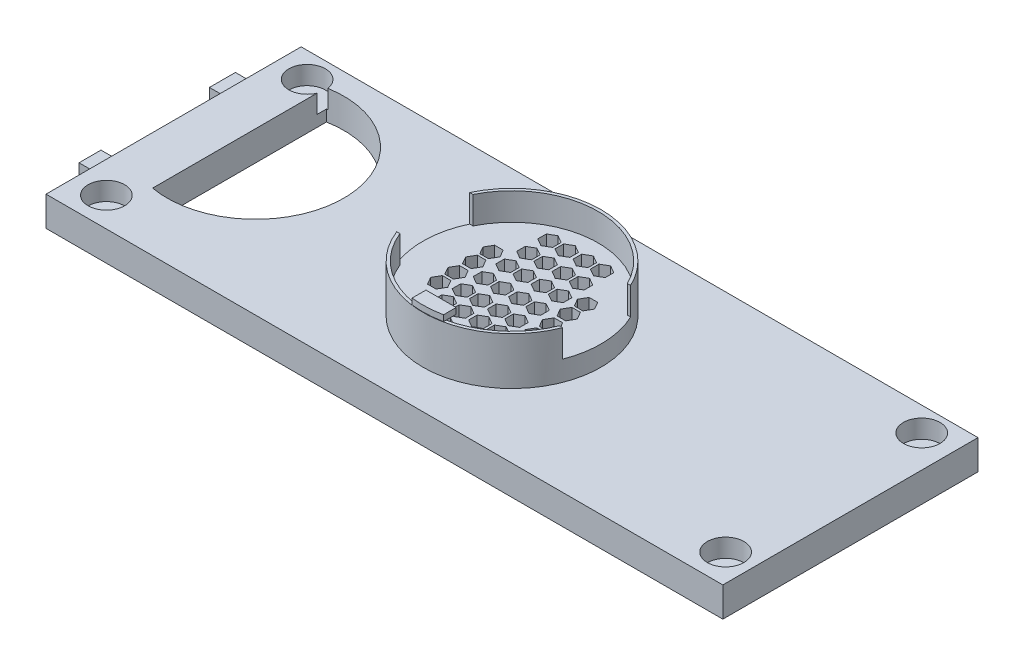
from build123d import *

# Parameters (mm, degrees)
SKETCH1_W           = 114
SKETCH1_H           = 42.97487903
BOSS_EXTRUDE1_DEPTH = 5
SKETCH3_R           = 3.08
CUT_EXTRUDE1_DEPTH  = 3.1
SKETCH5_W           = 4.374782862
SKETCH5_H           = 2
SKETCH5_W_2         = 3.698270048
SKETCH5_H_2         = 2.003550683
BOSS_EXTRUDE2_DEPTH = 3.1
SKETCH6_R           = 15
BOSS_EXTRUDE3_DEPTH = 8
SKETCH8_R           = 14.5
CUT_EXTRUDE2_DEPTH  = 4.6
SKETCH9_W           = 39.287811744
SKETCH9_H           = 11.865369085
CUT_EXTRUDE5_DEPTH  = 9.6
BOSS_EXTRUDE5_DEPTH = 1
CUT_EXTRUDE6_DEPTH  = 10
CUT_EXTRUDE7_DEPTH  = 10


with BuildPart() as part:
    # Sketch1 → Boss-Extrude1 (new body)
    with BuildSketch(Plane(origin=(0, 0, 0), x_dir=(1, 0, 0), z_dir=(0, 1, 0))):
        Rectangle(SKETCH1_W, SKETCH1_H)
    extrude(amount=BOSS_EXTRUDE1_DEPTH)

    # Sketch3 → Cut-Extrude1 (cut)
    with BuildSketch(Plane(origin=(0, 5, 0), x_dir=(1, 0, 0), z_dir=(0, 1, 0))):
        with Locations(Location((-51.753086156, 17.246929099, 0), (0, 0, 270))):
            Circle(SKETCH3_R)
        with Locations(Location((-51.753086156, -16.564851847, 0), (0, 0, 270))):
            Circle(SKETCH3_R)
        with Locations(Location((51.584956943, 17.425212087, 0), (0, 0, 270))):
            Circle(SKETCH3_R)
        with Locations(Location((52.43781039, -16.458146722, 0), (0, 0, 270))):
            Circle(SKETCH3_R)
    extrude(amount=-CUT_EXTRUDE1_DEPTH, mode=Mode.SUBTRACT)

    # Sketch5 → Boss-Extrude2 (add)
    with BuildSketch(Plane.ZY.offset(57)):
        with Locations((-11.3256423, 2.70029737)):
            Rectangle(SKETCH5_W, SKETCH5_H)
        with Locations((10.976730125, 2.691921307)):
            Rectangle(SKETCH5_W_2, SKETCH5_H_2)
    extrude(amount=BOSS_EXTRUDE2_DEPTH)

    # Sketch6 → Boss-Extrude3 (add)
    with BuildSketch(Plane(origin=(0, 5, 0), x_dir=(1, 0, 0), z_dir=(0, 1, 0))):
        with Locations(Location((0, 0, 0), (0, 0, 270))):
            Circle(SKETCH6_R)
    extrude(amount=BOSS_EXTRUDE3_DEPTH)

    # Sketch8 → Cut-Extrude2 (cut)
    with BuildSketch(Plane(origin=(0, 13, 0), x_dir=(1, 0, 0), z_dir=(0, 1, 0))):
        with Locations(Location((0, 0, 0), (0, 0, 270))):
            Circle(SKETCH8_R)
    extrude(amount=-CUT_EXTRUDE2_DEPTH, mode=Mode.SUBTRACT)

    # Sketch9 → Cut-Extrude5 (cut)
    with BuildSketch(Plane(origin=(0, 8.4, 0), x_dir=(1, 0, 0), z_dir=(0, 1, 0))):
        with Locations((1.303444601, 0.497081388)):
            Rectangle(SKETCH9_W, SKETCH9_H)
    extrude(amount=CUT_EXTRUDE5_DEPTH, mode=Mode.SUBTRACT)

    # Sketch11 → Boss-Extrude5 (add)
    with BuildSketch(Plane(origin=(0, 13, 0), x_dir=(1, 0, 0), z_dir=(0, 1, 0))):
        with BuildLine():
            Line((-2.008566412, -12.483358221), (-2.008566412, -14.813807369))
            ThreePointArc((-2.008566412, -14.813807369), (0.540430025, -14.915750705), (3.072767456, -14.607461209))
            Line((3.072767456, -14.607461209), (3.072767456, -12.483358221))
            Line((3.072767456, -12.483358221), (-2.008566412, -12.483358221))
        make_face()
    extrude(amount=BOSS_EXTRUDE5_DEPTH)

    # Sketch12 → Cut-Extrude6 (cut)
    with BuildSketch(Plane.XZ):
        Polygon((-1.381374518, -4.971139616), (-0.132784083, -4.250265592), (-0.132784083, -2.808517545), (-1.381374518, -2.087643522), (-2.629964952, -2.808517545), (-2.629964952, -4.250265592), align=None)
        Polygon((-4.289587549, -4.971139616), (-3.040997114, -4.250265592), (-3.040997114, -2.808517545), (-4.289587549, -2.087643522), (-5.538177984, -2.808517545), (-5.538177984, -4.250265592), align=None)
        Polygon((4.546381521, -5.001007602), (5.794971955, -4.280133578), (5.794971955, -2.838385531), (4.546381521, -2.117511507), (3.297791086, -2.838385531), (3.297791086, -4.280133578), align=None)
        Polygon((1.638168489, -5.001007602), (2.886758924, -4.280133578), (2.886758924, -2.838385531), (1.638168489, -2.117511507), (0.389578055, -2.838385531), (0.389578055, -4.280133578), align=None)
        Polygon((-1.44283189, -1.23420754), (-0.194241456, -0.513333516), (-0.194241456, 0.928414531), (-1.44283189, 1.649288554), (-2.691422325, 0.928414531), (-2.691422325, -0.513333516), align=None)
        Polygon((-4.351044922, -1.23420754), (-3.102454487, -0.513333516), (-3.102454487, 0.928414531), (-4.351044922, 1.649288554), (-5.599635356, 0.928414531), (-5.599635356, -0.513333516), align=None)
        Polygon((4.484924148, -1.264075525), (5.733514583, -0.543201502), (5.733514583, 0.898546545), (4.484924148, 1.619420569), (3.236333713, 0.898546545), (3.236333713, -0.543201502), align=None)
        Polygon((1.576711117, -1.264075525), (2.825301551, -0.543201502), (2.825301551, 0.898546545), (1.576711117, 1.619420569), (0.328120682, 0.898546545), (0.328120682, -0.543201502), align=None)
        Polygon((-1.44283189, 2.30846757), (-0.194241456, 3.029341594), (-0.194241456, 4.471089641), (-1.44283189, 5.191963664), (-2.691422325, 4.471089641), (-2.691422325, 3.029341594), align=None)
        Polygon((-4.351044922, 2.30846757), (-3.102454487, 3.029341594), (-3.102454487, 4.471089641), (-4.351044922, 5.191963664), (-5.599635356, 4.471089641), (-5.599635356, 3.029341594), align=None)
        Polygon((4.484924148, 2.278599584), (5.733514583, 2.999473608), (5.733514583, 4.441221655), (4.484924148, 5.162095679), (3.236333713, 4.441221655), (3.236333713, 2.999473608), align=None)
        Polygon((1.576711117, 2.278599584), (2.825301551, 2.999473608), (2.825301551, 4.441221655), (1.576711117, 5.162095679), (0.328120682, 4.441221655), (0.328120682, 2.999473608), align=None)
        Polygon((-1.424844788, 5.51653605), (-0.176254353, 6.237410074), (-0.176254353, 7.679158121), (-1.424844788, 8.400032145), (-2.673435223, 7.679158121), (-2.673435223, 6.237410074), align=None)
        Polygon((-4.333057819, 5.51653605), (-3.084467385, 6.237410074), (-3.084467385, 7.679158121), (-4.333057819, 8.400032145), (-5.581648254, 7.679158121), (-5.581648254, 6.237410074), align=None)
        Polygon((4.50291125, 5.486668065), (5.751501685, 6.207542088), (5.751501685, 7.649290135), (4.50291125, 8.370164159), (3.254320816, 7.649290135), (3.254320816, 6.207542088), align=None)
        Polygon((1.594698219, 5.486668065), (2.843288654, 6.207542088), (2.843288654, 7.649290135), (1.594698219, 8.370164159), (0.346107784, 7.649290135), (0.346107784, 6.207542088), align=None)
        Polygon((-1.406449515, 8.922934367), (-0.157859081, 9.643808391), (-0.157859081, 11.085556438), (-1.406449515, 11.806430461), (-2.65503995, 11.085556438), (-2.65503995, 9.643808391), align=None)
        Polygon((-4.314662547, 8.922934367), (-3.066072112, 9.643808391), (-3.066072112, 11.085556438), (-4.314662547, 11.806430461), (-5.563252981, 11.085556438), (-5.563252981, 9.643808391), align=None)
        Polygon((4.521306523, 8.893066382), (5.769896958, 9.613940405), (5.769896958, 11.055688452), (4.521306523, 11.776562476), (3.272716088, 11.055688452), (3.272716088, 9.613940405), align=None)
        Polygon((1.613093492, 8.893066382), (2.861683926, 9.613940405), (2.861683926, 11.055688452), (1.613093492, 11.776562476), (0.364503057, 11.055688452), (0.364503057, 9.613940405), align=None)
        Polygon((-1.466720513, -8.578903548), (-0.218130079, -7.858029525), (-0.218130079, -6.416281478), (-1.466720513, -5.695407454), (-2.715310948, -6.416281478), (-2.715310948, -7.858029525), align=None)
        Polygon((-4.374933545, -8.578903548), (-3.12634311, -7.858029525), (-3.12634311, -6.416281478), (-4.374933545, -5.695407454), (-5.623523979, -6.416281478), (-5.623523979, -7.858029525), align=None)
        Polygon((4.461035525, -8.608771534), (5.70962596, -7.88789751), (5.70962596, -6.446149463), (4.461035525, -5.72527544), (3.212445091, -6.446149463), (3.212445091, -7.88789751), align=None)
        Polygon((1.552822494, -8.608771534), (2.801412928, -7.88789751), (2.801412928, -6.446149463), (1.552822494, -5.72527544), (0.304232059, -6.446149463), (0.304232059, -7.88789751), align=None)
        Polygon((-1.502478081, -12.162894804), (-0.253887646, -11.44202078), (-0.253887646, -10.000272733), (-1.502478081, -9.27939871), (-2.751068515, -10.000272733), (-2.751068515, -11.44202078), align=None)
        Polygon((-4.410691112, -12.162894804), (-3.162100678, -11.44202078), (-3.162100678, -10.000272733), (-4.410691112, -9.27939871), (-5.659281547, -10.000272733), (-5.659281547, -11.44202078), align=None)
        Polygon((4.425277958, -12.19276279), (5.673868392, -11.471888766), (5.673868392, -10.030140719), (4.425277958, -9.309266696), (3.176687523, -10.030140719), (3.176687523, -11.471888766), align=None)
        Polygon((1.517064926, -12.19276279), (2.765655361, -11.471888766), (2.765655361, -10.030140719), (1.517064926, -9.309266696), (0.268474492, -10.030140719), (0.268474492, -11.471888766), align=None)
        Polygon((-6.210185925, -1.290453118), (-6.931059949, -0.041862683), (-8.372807996, -0.041862683), (-9.09368202, -1.290453118), (-8.372807996, -2.539043553), (-6.931059949, -2.539043553), align=None)
        Polygon((-6.210185925, -4.198666149), (-6.931059949, -2.950075715), (-8.372807996, -2.950075715), (-9.09368202, -4.198666149), (-8.372807996, -5.447256584), (-6.931059949, -5.447256584), align=None)
        Polygon((-6.18031794, 4.63730292), (-6.901191963, 5.885893355), (-8.34294001, 5.885893355), (-9.063814034, 4.63730292), (-8.34294001, 3.388712486), (-6.901191963, 3.388712486), align=None)
        Polygon((-6.18031794, 1.729089889), (-6.901191963, 2.977680324), (-8.34294001, 2.977680324), (-9.063814034, 1.729089889), (-8.34294001, 0.480499454), (-6.901191963, 0.480499454), align=None)
        Polygon((9.364060005, -1.631856694), (8.643185981, -0.383266259), (7.201437934, -0.383266259), (6.480563911, -1.631856694), (7.201437934, -2.880447128), (8.643185981, -2.880447128), align=None)
        Polygon((9.364060005, -4.540069725), (8.643185981, -3.29147929), (7.201437934, -3.29147929), (6.480563911, -4.540069725), (7.201437934, -5.78866016), (8.643185981, -5.78866016), align=None)
        Polygon((9.393927991, 4.295899345), (8.673053967, 5.544489779), (7.23130592, 5.544489779), (6.510431896, 4.295899345), (7.23130592, 3.04730891), (8.673053967, 3.04730891), align=None)
        Polygon((9.393927991, 1.387686313), (8.673053967, 2.636276748), (7.23130592, 2.636276748), (6.510431896, 1.387686313), (7.23130592, 0.139095879), (8.673053967, 0.139095879), align=None)
    extrude(amount=-CUT_EXTRUDE6_DEPTH, mode=Mode.SUBTRACT)

    # Sketch13 → Cut-Extrude7 (cut)
    with BuildSketch(Plane.XZ):
        with BuildLine():
            ThreePointArc((-48.9, 11.627344184), (-31.323650484, -3.010124636), (-48.9, -17.647593457))
            Line((-48.9, -17.647593457), (-48.9, 11.627344184))
        make_face()
    extrude(amount=-CUT_EXTRUDE7_DEPTH, mode=Mode.SUBTRACT)


solid = part.part
